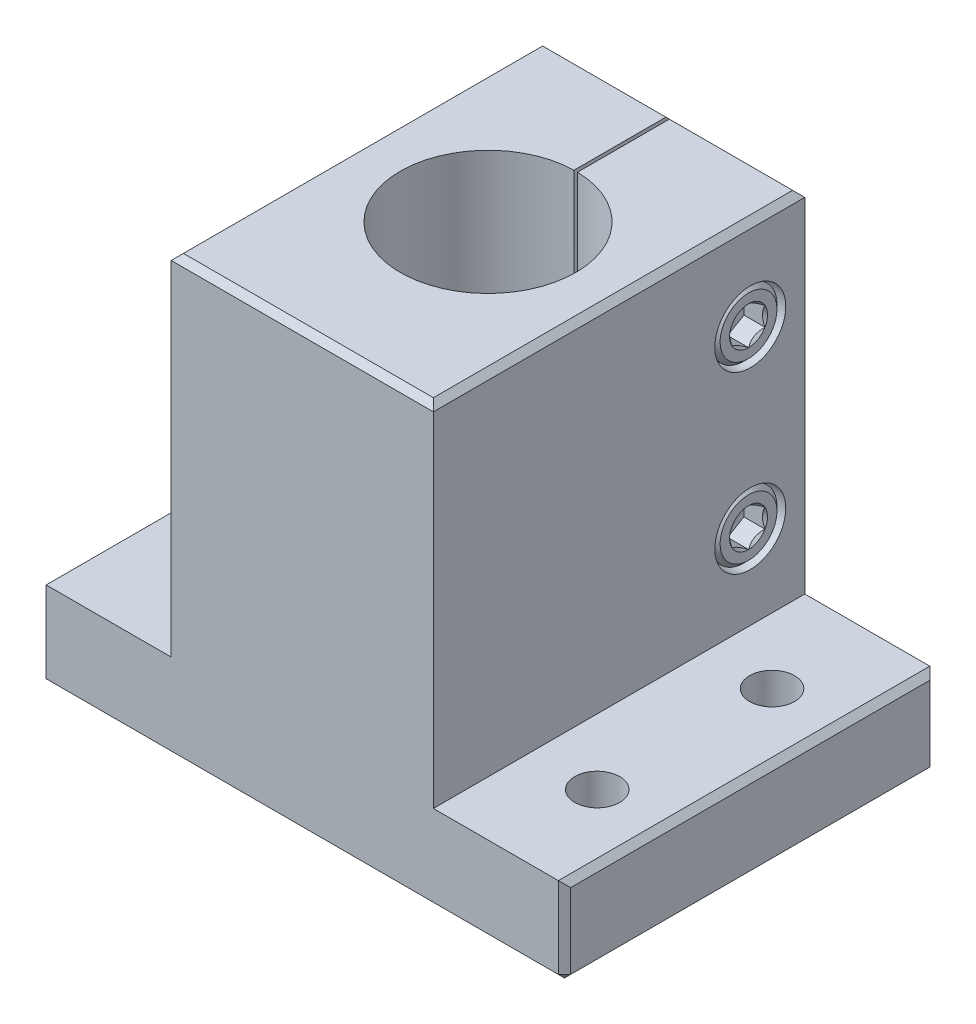
from build123d import *

# Parameters (mm, degrees)
BOSS_EXTRUDE1_DEPTH = 26.9875
CHAMFER1_SIZE       = 0.889
SKETCH2_R           = 3.2639
CUT_EXTRUDE1_DEPTH  = 79.817416579
SKETCH4_R           = 12.7508
CUT_EXTRUDE2_DEPTH  = 79.817416579
CUT_EXTRUDE3_DEPTH  = 79.817416579
CUT_EXTRUDE4_DEPTH  = 3.048
LPATTERN1_COUNT     = 2
LPATTERN1_PITCH     = 25.4
LPATTERN2_COUNT     = 2
LPATTERN2_PITCH     = 25.4


with BuildPart() as part:
    # Sketch1 → Boss-Extrude1 (new, symmetric)
    with BuildSketch(Plane.XY):
        Polygon((-38.1, 0), (38.1, 0), (38.1, 12.7), (19.05, 12.7), (19.05, 63.5), (-19.05, 63.5), (-19.05, 12.7), (-38.1, 12.7), align=None)
    extrude(amount=BOSS_EXTRUDE1_DEPTH, both=True)

    # Chamfer1
    chamfer1_edges = [part.edges().sort_by_distance(p)[0] for p in [
        (-38.1, 0, 0),
        (-38.1, 6.35, 26.9875),
        (0, 0, 26.9875),
        (-38.1, 6.35, -26.9875),
        (0, 0, -26.9875),
        (38.1, 6.35, -26.9875),
        (38.1, 0, 0),
        (38.1, 6.35, 26.9875),
        (0, 63.5, 26.9875),
        (-19.05, 63.5, 0),
        (0, 63.5, -26.9875),
        (-38.1, 12.7, 0),
        (38.1, 12.7, 0),
        (19.05, 63.5, 0),
    ]]
    chamfer(chamfer1_edges, length=CHAMFER1_SIZE)

    # Sketch2 → Cut-Extrude1 (cut, through all)
    with BuildSketch(Plane(origin=(0, 0, 0), x_dir=(1, 0, 0), z_dir=(0, 1, 0))):
        with Locations((-28.575, -12.7)):
            Circle(SKETCH2_R)
        with Locations((28.575, -12.7)):
            Circle(SKETCH2_R)
        with Locations((-28.575, 12.7)):
            Circle(SKETCH2_R)
        with Locations((28.575, 12.7)):
            Circle(SKETCH2_R)
    extrude(amount=CUT_EXTRUDE1_DEPTH, mode=Mode.SUBTRACT)

    # Sketch3 → Cut-Revolve1 (revolve, cut)
    with BuildSketch(Plane.XY.offset(-19.0627)):
        Polygon((-19.05, 50.292), (-19.05, 53.467), (-1.27, 53.467), (-1.27, 53.5559), (12.446, 53.5559), (12.446, 55.4482), (19.05, 55.4482), (19.05, 50.292), align=None)
    cut_revolve1 = revolve(axis=Axis((19.05, 50.292, -19.0627), (-1, 0, 0)), mode=Mode.SUBTRACT)

    # Sketch4 → Cut-Extrude2 (cut, through all)
    with BuildSketch(Plane(origin=(0, 0, 0), x_dir=(1, 0, 0), z_dir=(0, 1, 0))):
        Circle(SKETCH4_R)
    extrude(amount=CUT_EXTRUDE2_DEPTH, mode=Mode.SUBTRACT)

    # Sketch5 → Cut-Extrude3 (cut, through all)
    with BuildSketch(Plane.XY):
        with BuildLine():
            Line((-7.874, 7.874), (-7.874, 0))
            Line((-7.874, 0), (7.874, 0))
            Line((7.874, 0), (7.874, 7.874))
            ThreePointArc((7.874, 7.874), (5.656848593, 13.351220098), (0.254, 15.743902159))
            Line((0.254, 15.743902159), (0.254, 63.5))
            Line((0.254, 63.5), (-0.254, 63.5))
            Line((-0.254, 63.5), (-0.254, 15.743902159))
            ThreePointArc((-0.254, 15.743902159), (-5.656848593, 13.351220098), (-7.874, 7.874))
        make_face()
    extrude(amount=-CUT_EXTRUDE3_DEPTH, mode=Mode.SUBTRACT)

    # LPattern1: Cut-Revolve1 ×2
    with Locations(*[(0, -i * LPATTERN1_PITCH, 0) for i in range(1, LPATTERN1_COUNT)]):
        add(cut_revolve1, mode=Mode.SUBTRACT)


with BuildPart() as body_2:
    # Sketch6 → Revolve1 (revolve)
    with BuildSketch(Plane.XY.offset(-19.0627)):
        Polygon((-12.954, 50.292), (-12.954, 53.467), (12.446, 53.467), (12.446, 54.9275), (12.573, 55.0545), (18.161, 55.0545), (18.796, 54.4195), (18.796, 50.292), align=None)
    revolve(axis=Axis((18.796, 50.292, -19.0627), (-1, 0, 0)))

    # Sketch7 → Cut-Extrude4 (cut)
    with BuildSketch(Plane(origin=(18.796, 0, 0), x_dir=(0, 0, -1), z_dir=(1, 0, 0))):
        Polygon((19.0627, 53.048963005), (16.6751, 51.670481503), (16.6751, 48.913518497), (19.0627, 47.535036995), (21.4503, 48.913518497), (21.4503, 51.670481503), align=None)
    extrude(amount=-CUT_EXTRUDE4_DEPTH, mode=Mode.SUBTRACT)

    # Cut-Extrude5 cone 1 section (through the dimple's axis) → Cut-Extrude5 (revolve, cut)
    with BuildSketch(Plane(origin=(18.796, 50.292, -19.0627), x_dir=(0, 0, -1), z_dir=(0, 1, 0))):
        Polygon((0, 0), (2.756963005, 0), (0, 2.756963005), align=None)
    revolve(axis=Axis((18.796, 50.292, -19.0627), (-1, 0, 0)), mode=Mode.SUBTRACT)


with BuildPart() as lpattern2_1:
    # LPattern2: pattern copy
    add(body_2.part.moved(Location(Vector(0, -1, 0) * (1 * LPATTERN2_PITCH))))


solid = Compound([part.part, body_2.part, lpattern2_1.part])
